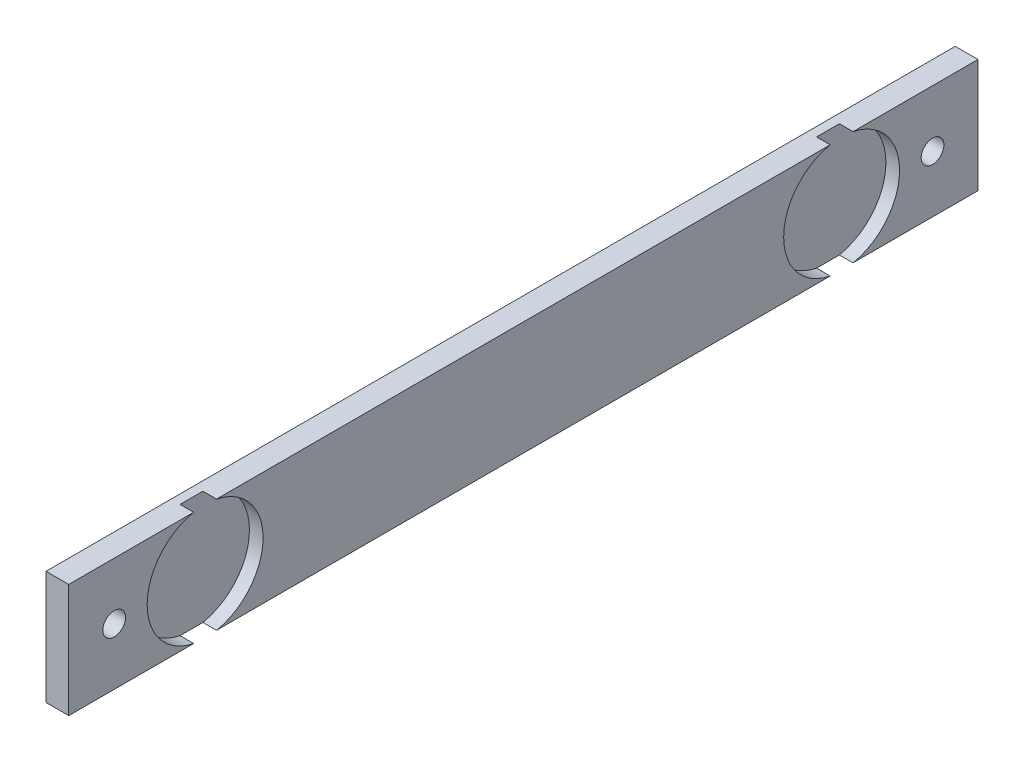
from build123d import *

# Parameters (mm, degrees)
SKETCH_1_W          = 80
SKETCH_1_H          = 10
EXTRUDE_1_DEPTH     = 2
SKETCH_2_R          = 1
CUT_EXTRUDE_1_DEPTH = 2
SKETCH_5_R          = 5.1
CUT_EXTRUDE_2_DEPTH = 1.2


with BuildPart() as part:
    # 草图1 → 凸台-拉伸1 (new body)
    with BuildSketch(Plane(origin=(0, 0, 0), x_dir=(0, 0, -1), z_dir=(1, 0, 0))):
        with Locations((-40, 5)):
            Rectangle(SKETCH_1_W, SKETCH_1_H)
    extrude(amount=EXTRUDE_1_DEPTH)

    # 草图2 → 切除-拉伸1 (cut)
    with BuildSketch(Plane(origin=(2, 0, 0), x_dir=(0, 0, -1), z_dir=(1, 0, 0))):
        with Locations((-76, 5)):
            Circle(SKETCH_2_R)
        with Locations((-4, 5)):
            Circle(SKETCH_2_R)
    extrude(amount=-CUT_EXTRUDE_1_DEPTH, mode=Mode.SUBTRACT)

    # 草图5 → 切除-拉伸2 (cut)
    with BuildSketch(Plane(origin=(2, 0, 0), x_dir=(0, 0, -1), z_dir=(1, 0, 0))):
        with Locations((-68, 5)):
            Circle(SKETCH_5_R)
        with Locations((-12, 5)):
            Circle(SKETCH_5_R)
    extrude(amount=-CUT_EXTRUDE_2_DEPTH, mode=Mode.SUBTRACT)


solid = part.part
